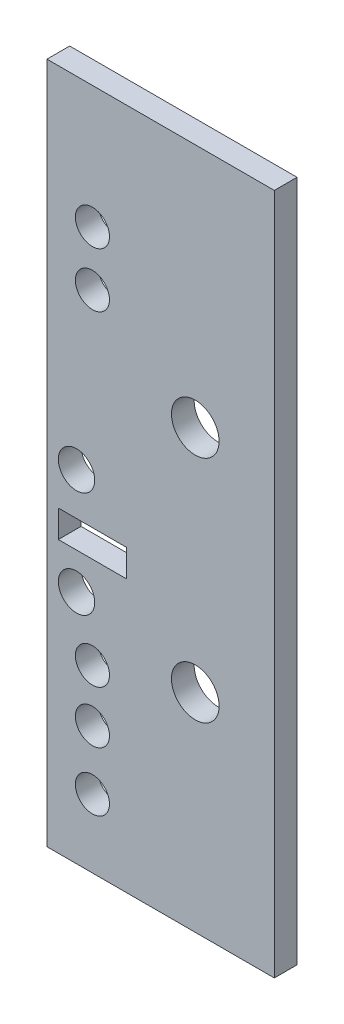
from build123d import *

# Parameters (mm, degrees)
SKETCH_1_W          = 50
SKETCH_1_H          = 150
EXTRUDE_1_DEPTH     = 5
SKETCH_2_R          = 3.75
CUT_EXTRUDE_1_DEPTH = 5
SKETCH_3_R          = 4
CUT_EXTRUDE_2_DEPTH = 5
SKETCH_4_W          = 15
SKETCH_4_H          = 6
CUT_EXTRUDE_3_DEPTH = 5
SKETCH_5_R          = 5.24
CUT_EXTRUDE_4_DEPTH = 5


with BuildPart() as part:
    # 草图1 → 凸台-拉伸1 (new body)
    with BuildSketch(Plane.XY):
        with Locations((1.67844523, -33.188535046)):
            Rectangle(SKETCH_1_W, SKETCH_1_H)
    extrude(amount=EXTRUDE_1_DEPTH)

    # 草图2 → 切除-拉伸1 (cut)
    with BuildSketch(Plane.XY.offset(5)):
        with Locations((-13.32155477, -93.188535046)):
            Circle(SKETCH_2_R)
        with Locations((-13.32155477, -80.188535046)):
            Circle(SKETCH_2_R)
        with Locations((-13.32155477, -68.648535046)):
            Circle(SKETCH_2_R)
        with Locations((-13.32155477, 2.849464954)):
            Circle(SKETCH_2_R)
        with Locations((-13.32155477, 14.863464954)):
            Circle(SKETCH_2_R)
    extrude(amount=-CUT_EXTRUDE_1_DEPTH, mode=Mode.SUBTRACT)

    # 草图3 → 切除-拉伸2 (cut)
    with BuildSketch(Plane.XY.offset(5)):
        with Locations((-16.82155477, -56.429938563)):
            Circle(SKETCH_3_R)
        with Locations((-16.82155477, -33.139938563)):
            Circle(SKETCH_3_R)
    extrude(amount=-CUT_EXTRUDE_2_DEPTH, mode=Mode.SUBTRACT)

    # 草图4 → 切除-拉伸3 (cut)
    with BuildSketch(Plane.XY.offset(5)):
        with Locations((-13.32155477, -45.429938563)):
            Rectangle(SKETCH_4_W, SKETCH_4_H)
    extrude(amount=-CUT_EXTRUDE_3_DEPTH, mode=Mode.SUBTRACT)

    # 草图5 → 切除-拉伸4 (cut)
    with BuildSketch(Plane.XY.offset(5)):
        with Locations((9.295497906, -12.060281788)):
            Circle(SKETCH_5_R)
        with Locations((9.295497906, -62.477916171)):
            Circle(SKETCH_5_R)
    extrude(amount=-CUT_EXTRUDE_4_DEPTH, mode=Mode.SUBTRACT)


solid = part.part
